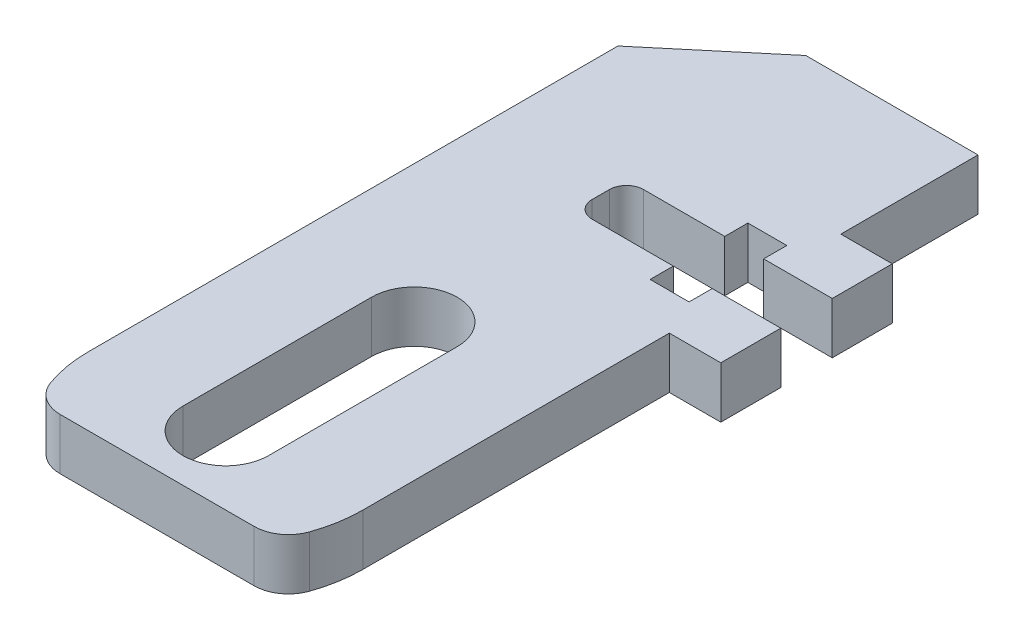
from build123d import *

# Parameters (mm, degrees)
BOSS_EXTRUDE1_DEPTH     = 1.5
CUT_EXTRUDE1_DEPTH      = 38.54894195
CUT_EXTRUDE1_DEPTH_BACK = 38.54894195


with BuildPart() as part:
    # Sketch2 → Boss-Extrude1 (new, symmetric)
    with BuildSketch(Plane(origin=(0, 0, 0), x_dir=(1, 0, 0), z_dir=(0, 1, 0))):
        with BuildLine():
            Line((-8, 10.748624987), (-8, 30.870225))
            Line((-8, 30.870225), (-2.041232037, 35.870225))
            Line((-2.041232037, 35.870225), (8, 35.870225))
            Line((8, 35.870225), (8, 30.870225))
            Line((8, 30.870225), (8, 27.870225))
            Line((8, 27.870225), (11, 27.870225))
            Line((11, 27.870225), (11, 17.870225))
            Line((11, 17.870225), (8, 17.870225))
            Line((8, 17.870225), (8, 14.870225))
            Line((8, 14.870225), (8, 10.748624987))
            Line((8, 10.748624987), (8, 0))
            ThreePointArc((8, 0), (7.884788477, -1.35281583), (7.542472333, -2.666666667))
            ThreePointArc((7.542472333, -2.666666667), (6.811554788, -3.632993162), (5.656854249, -4))
            Line((5.656854249, -4), (-5.656854249, -4))
            ThreePointArc((-5.656854249, -4), (-6.811554788, -3.632993162), (-7.542472333, -2.666666667))
            ThreePointArc((-7.542472333, -2.666666667), (-7.884788477, -1.35281583), (-8, 0))
            Line((-8, 0), (-8, 10.748624987))
        make_face()
        with BuildLine():
            Line((-2.5, 0), (-2.5, 11))
            ThreePointArc((-2.5, 11), (0, 13.5), (2.5, 11))
            Line((2.5, 11), (2.5, 0))
            ThreePointArc((2.5, 0), (0, -2.5), (-2.5, 0))
        make_face(mode=Mode.SUBTRACT)
    extrude(amount=BOSS_EXTRUDE1_DEPTH, both=True)

    # Sketch4 → Cut-Extrude1 (cut, two sides: drawn at the far end of the back side and taken through both)
    with BuildSketch(Plane(origin=(0, 0, 0), x_dir=(1, 0, 0), z_dir=(0, 1, 0)).offset(-CUT_EXTRUDE1_DEPTH_BACK)):
        with BuildLine():
            Line((11, 24.370225), (7, 24.370225))
            Line((7, 24.370225), (7, 25.720225))
            Line((7, 25.720225), (4.73, 25.720225))
            Line((4.73, 25.720225), (4.73, 24.370225))
            Line((4.73, 24.370225), (0, 24.370225))
            ThreePointArc((0, 24.370225), (-0.707106781, 24.077331781), (-1, 23.370225))
            Line((-1, 23.370225), (-1, 22.370225))
            ThreePointArc((-1, 22.370225), (-0.707106781, 21.663118219), (0, 21.370225))
            Line((0, 21.370225), (4.73, 21.370225))
            Line((4.73, 21.370225), (4.73, 20.020225))
            Line((4.73, 20.020225), (7, 20.020225))
            Line((7, 20.020225), (7, 21.370225))
            Line((7, 21.370225), (11, 21.370225))
            Line((11, 21.370225), (11, 24.370225))
        make_face()
    extrude(amount=CUT_EXTRUDE1_DEPTH + CUT_EXTRUDE1_DEPTH_BACK, mode=Mode.SUBTRACT)


solid = part.part
